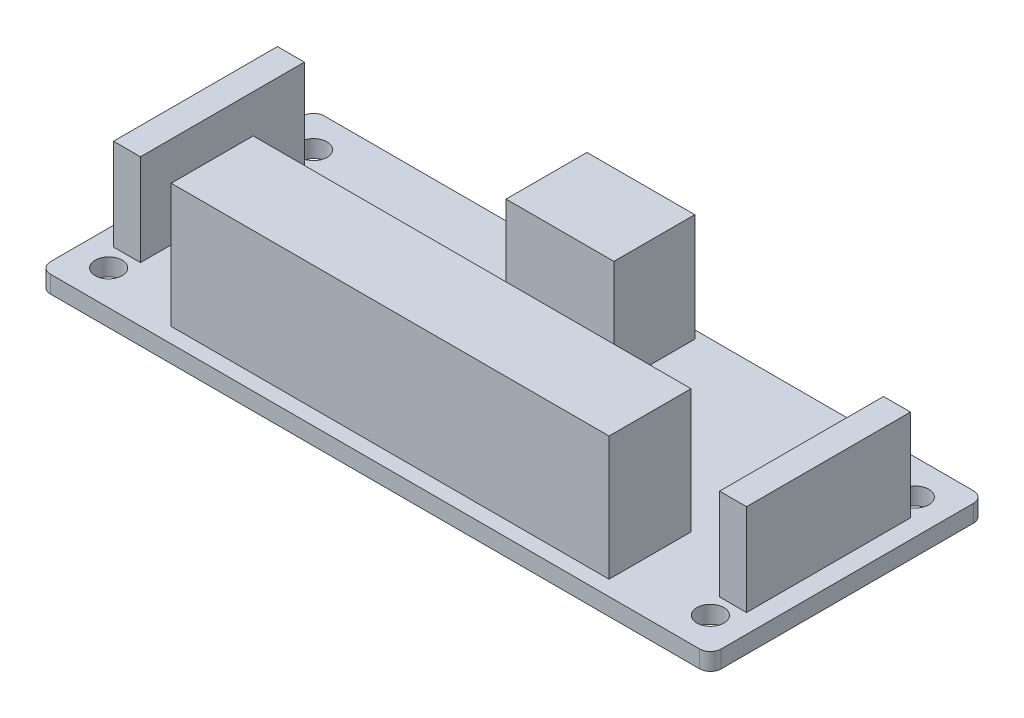
from build123d import *

# Parameters (mm, degrees)
BOARD_START         = 8.5
SKETCH1_R           = 1.25
BOARD_DEPTH         = 1.6
SERVO_START         = 10.1
SKETCH2_W           = 40.6
SKETCH2_H           = 7.6
SERVO_HEADERS_DEPTH = 11.5
V_START             = 10.1
SKETCH3_W           = 10
SKETCH3_H           = 7.5
V_TERMINAL_DEPTH    = 10
I2C_START           = 10.1
SKETCH4_W           = 2.5
SKETCH4_H           = 15.2
I2C_HEADERS_DEPTH   = 8.5


with BuildPart() as part:
    # Sketch1 → Board (new body)
    with BuildSketch(Plane(origin=(0, 0, 0), x_dir=(1, 0, 0), z_dir=(0, 1, 0)).offset(BOARD_START)):
        with BuildLine():
            Line((-30.1, 50.7), (30.1, 50.7))
            ThreePointArc((30.1, 50.7), (30.807106781, 50.407106781), (31.1, 49.7))
            Line((31.1, 49.7), (31.1, 26.3))
            ThreePointArc((31.1, 26.3), (30.807106781, 25.592893219), (30.1, 25.3))
            Line((30.1, 25.3), (-30.1, 25.3))
            ThreePointArc((-30.1, 25.3), (-30.807106781, 25.592893219), (-31.1, 26.3))
            Line((-31.1, 26.3), (-31.1, 49.7))
            ThreePointArc((-31.1, 49.7), (-30.807106781, 50.407106781), (-30.1, 50.7))
        make_face()
        with Locations(Location((-27.9, 47.5, 0), (0, 0, 270))):
            Circle(SKETCH1_R, mode=Mode.SUBTRACT)
        with Locations(Location((-27.9, 28.5, 0), (0, 0, 270))):
            Circle(SKETCH1_R, mode=Mode.SUBTRACT)
        with Locations(Location((27.9, 47.5, 0), (0, 0, 270))):
            Circle(SKETCH1_R, mode=Mode.SUBTRACT)
        with Locations(Location((27.9, 28.5, 0), (0, 0, 270))):
            Circle(SKETCH1_R, mode=Mode.SUBTRACT)
    extrude(amount=BOARD_DEPTH)

    # Sketch2 → Servo headers (add)
    with BuildSketch(Plane(origin=(0, 0, 0), x_dir=(1, 0, 0), z_dir=(0, 1, 0)).offset(SERVO_START)):
        with Locations((0, 30.5)):
            Rectangle(SKETCH2_W, SKETCH2_H)
    extrude(amount=SERVO_HEADERS_DEPTH)

    # Sketch3 → V+ terminal (add)
    with BuildSketch(Plane(origin=(0, 0, 0), x_dir=(1, 0, 0), z_dir=(0, 1, 0)).offset(V_START)):
        with Locations((0, 46.2)):
            Rectangle(SKETCH3_W, SKETCH3_H)
    extrude(amount=V_TERMINAL_DEPTH)

    # Sketch4 → I2C headers (add)
    with BuildSketch(Plane(origin=(0, 0, 0), x_dir=(1, 0, 0), z_dir=(0, 1, 0)).offset(I2C_START)):
        with Locations((-28.1, 38)):
            Rectangle(SKETCH4_W, SKETCH4_H)
        with Locations((28.1, 38)):
            Rectangle(SKETCH4_W, SKETCH4_H)
    extrude(amount=I2C_HEADERS_DEPTH)


solid = part.part
